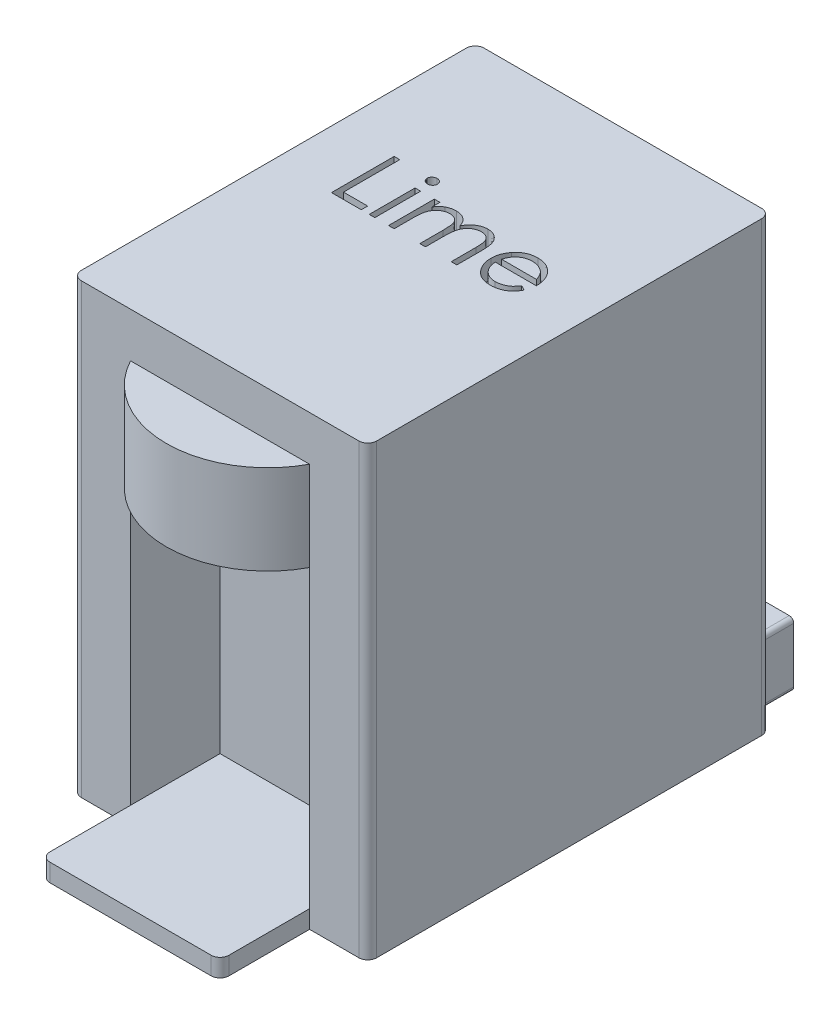
from build123d import *

# Parameters (mm, degrees)
SKETCH1_W           = 330
SKETCH1_H           = 450
BOSS_EXTRUDE1_DEPTH = 500
SKETCH2_W           = 200
SKETCH2_H           = 350
CUT_EXTRUDE1_DEPTH  = 100
BOSS_EXTRUDE2_DEPTH = 100
SKETCH4_W           = 200
SKETCH4_H           = 20
BOSS_EXTRUDE3_DEPTH = 200
SKETCH5_R           = 58.984993577
CUT_EXTRUDE2_DEPTH  = 50
FILLET1_R           = 10
SKETCH6_W           = 108.793875533
SKETCH6_H           = 71.48855694
BOSS_EXTRUDE4_DEPTH = 50
FILLET2_R           = 5
FILLET3_R           = 10
SKETCH7_W           = 6.282051282
SKETCH7_H           = 51.153846154
CUT_EXTRUDE3_DEPTH  = 20


with BuildPart() as part:
    # Sketch1 → Boss-Extrude1 (new body)
    with BuildSketch(Plane(origin=(0, 0, 0), x_dir=(1, 0, 0), z_dir=(0, 1, 0))):
        Rectangle(SKETCH1_W, SKETCH1_H)
    extrude(amount=BOSS_EXTRUDE1_DEPTH)

    # Sketch2 → Cut-Extrude1 (cut)
    with BuildSketch(Plane.XY.offset(225)):
        with Locations((0, 175)):
            Rectangle(SKETCH2_W, SKETCH2_H)
    extrude(amount=-CUT_EXTRUDE1_DEPTH, mode=Mode.SUBTRACT)

    # Sketch3 → Boss-Extrude2 (add)
    with BuildSketch(Plane.XZ.offset(-350)):
        with BuildLine():
            Line((100, 225), (-100, 225))
            ThreePointArc((-100, 225), (0, 284.9775435), (100, 225))
        make_face()
    extrude(amount=-BOSS_EXTRUDE2_DEPTH)

    # Sketch4 → Boss-Extrude3 (add)
    with BuildSketch(Plane.XY.offset(125)):
        with Locations((0, 10)):
            Rectangle(SKETCH4_W, SKETCH4_H)
    extrude(amount=BOSS_EXTRUDE3_DEPTH)

    # Sketch5 → Cut-Extrude2 (cut)
    with BuildSketch(Plane.XZ.offset(-350)):
        with Locations((0, 203.171289973)):
            Circle(SKETCH5_R)
    extrude(amount=-CUT_EXTRUDE2_DEPTH, mode=Mode.SUBTRACT)

    # Fillet1
    fillet1_edges = [part.edges().sort_by_distance(p)[0] for p in [
        (165, 250, 225),
        (-165, 250, 225),
        (-165, 250, -225),
        (165, 250, -225),
    ]]
    fillet(fillet1_edges, radius=FILLET1_R)

    # Sketch6 → Boss-Extrude4 (add)
    with BuildSketch(Plane(origin=(0, 0, -225), x_dir=(-1, 0, 0), z_dir=(0, 0, -1))):
        with Locations((-86.447180312, 35.74427847)):
            Rectangle(SKETCH6_W, SKETCH6_H)
    extrude(amount=BOSS_EXTRUDE4_DEPTH)

    # Fillet2
    fillet2_edges = [part.edges().sort_by_distance(p)[0] for p in [
        (140.844118078, 71.48855694, -250),
        (140.844118078, 0, -250),
        (32.050242545, 0, -250),
        (32.050242545, 71.48855694, -250),
    ]]
    fillet(fillet2_edges, radius=FILLET2_R)

    # Fillet3
    fillet3_edges = [part.edges().sort_by_distance(p)[0] for p in [
        (-100, 10, 325),
        (100, 10, 325),
    ]]
    fillet(fillet3_edges, radius=FILLET3_R)

    # Sketch7 → Cut-Extrude3 (cut)
    # profile 1 of 5: a face of its own
    with BuildSketch(Plane(origin=(0, 500, 0), x_dir=(1, 0, 0), z_dir=(0, 1, 0))):
        Polygon((-100.512820513, 70), (-94.230769231, 70), (-94.230769231, 7.179487179), (-67.307692308, 7.179487179), (-67.307692308, 0), (-100.512820513, 0), align=None)
    # profile 2 of 5: a face of its own
    with BuildSketch(Plane(origin=(0, 500, 0), x_dir=(1, 0, 0), z_dir=(0, 1, 0))):
        with BuildLine():
            add(Edge.make_bspline(
                [(-55.220352564, 72.692307692), (-54.830526248, 72.674224644), (-54.067171451, 72.638814564), (-52.963306098, 72.335585022), (-51.958165856, 71.821591313), (-51.066611199, 71.131997695), (-50.301573465, 70.321008826), (-49.765959258, 69.37578946), (-49.421711335, 68.354616684), (-49.38014023, 67.642314901), (-49.358974359, 67.279647436)],
                knots=[0, 0, 0, 0, 1.055194115, 2.066272739, 3.074728998, 4.095836921, 5.109056067, 6.073838105, 7.019297344, 8, 8, 8, 8], degree=3))
            add(Edge.make_bspline(
                [(-49.358974359, 67.279647436), (-49.380617555, 66.926394373), (-49.423403594, 66.228054872), (-49.765693359, 65.224585431), (-50.306138115, 64.292499762), (-51.066120628, 63.483085557), (-51.958295848, 62.793873158), (-52.963271565, 62.279778379), (-54.067180535, 61.976575632), (-54.830529319, 61.941161857), (-55.220352564, 61.923076923)],
                knots=[0, 0, 0, 0, 0.96129708, 1.900370562, 2.859976407, 3.87933698, 4.906634145, 5.921202961, 6.938410037, 8, 8, 8, 8], degree=3))
            add(Edge.make_bspline(
                [(-55.220352564, 61.923076923), (-55.605718067, 61.940471328), (-56.355781671, 61.974327263), (-57.443118518, 62.285727618), (-58.439688305, 62.79404908), (-59.332981759, 63.478572782), (-60.077585621, 64.297470726), (-60.619552129, 65.224016603), (-60.961051367, 66.228199696), (-61.003943939, 66.926443022), (-61.025641026, 67.279647436)],
                knots=[0, 0, 0, 0, 1.054934014, 2.053291228, 3.073705704, 4.106921865, 5.123545215, 6.088680038, 7.033164197, 8, 8, 8, 8], degree=3))
            add(Edge.make_bspline(
                [(-61.025641026, 67.279647436), (-61.004419293, 67.642264428), (-60.962738472, 68.35446708), (-60.619296149, 69.376367739), (-60.082099994, 70.315997775), (-59.332488723, 71.136507763), (-58.439819518, 71.821416458), (-57.443084615, 72.329636089), (-56.355790627, 72.641062876), (-55.605721107, 72.674915163), (-55.220352564, 72.692307692)],
                knots=[0, 0, 0, 0, 0.98631895, 1.937192651, 2.907499808, 3.917963147, 4.944918757, 5.95915025, 6.951458133, 8, 8, 8, 8], degree=3))
        make_face()
    # profile 3 of 5: a face of its own
    with BuildSketch(Plane(origin=(0, 500, 0), x_dir=(1, 0, 0), z_dir=(0, 1, 0))):
        with Locations((-55.192307692, 25.576923077)):
            Rectangle(SKETCH7_W, SKETCH7_H)
    # profile 4 of 5: a face of its own
    with BuildSketch(Plane(origin=(0, 500, 0), x_dir=(1, 0, 0), z_dir=(0, 1, 0))):
        with BuildLine():
            Line((-36.794871795, 51.153846154), (-30.512820513, 51.153846154))
            Line((-30.512820513, 51.153846154), (-30.512820513, 42.263621795))
            add(Edge.make_bspline(
                [(-30.512820513, 42.263621795), (-29.947141515, 43.041373829), (-28.863246322, 44.531621291), (-27.085933272, 46.495426975), (-25.310411023, 48.161990069), (-24.031743387, 49.036847501), (-23.417467949, 49.45713141)],
                knots=[0, 0, 0, 0, 1.134379233, 2.173579362, 3.122582517, 4, 4, 4, 4], degree=3))
            add(Edge.make_bspline(
                [(-23.417467949, 49.45713141), (-22.580174705, 49.857238715), (-20.92021671, 50.650462982), (-18.291832212, 51.455134161), (-15.602338821, 51.949636188), (-13.786174543, 52.017263656), (-12.872596154, 52.051282051)],
                knots=[0, 0, 0, 0, 1.014936303, 2.012140481, 3.000054389, 4, 4, 4, 4], degree=3))
            add(Edge.make_bspline(
                [(-12.872596154, 52.051282051), (-12.254736222, 52.030376236), (-11.032024642, 51.989004751), (-9.22034284, 51.719804047), (-7.463170603, 51.254480587), (-5.770890016, 50.606334107), (-4.176476431, 49.821400369), (-2.714692476, 48.900406211), (-1.402208312, 47.866464703), (-0.239687286, 46.672886043), (0.805693222, 45.286154073), (1.767270154, 43.668869095), (2.655774402, 41.784715873), (3.148200579, 40.417385054), (3.407451923, 39.697516026)],
                knots=[0, 0, 0, 0, 1.009824226, 1.998387844, 2.986035974, 3.974953746, 4.955485308, 5.885931332, 6.793869504, 7.679848016, 8.601185859, 9.625726857, 10.749998409, 12, 12, 12, 12], degree=3))
            add(Edge.make_bspline(
                [(3.407451923, 39.697516026), (3.68167695, 40.192004411), (4.221313293, 41.16508811), (5.127426034, 42.542253355), (6.076781964, 43.830389192), (7.077471825, 45.030517679), (8.125963562, 46.136712288), (9.227191568, 47.152630321), (10.374887196, 48.082634594), (11.970731994, 49.169097785), (14.046984142, 50.323121412), (16.664746436, 51.323690292), (19.387749868, 51.942012859), (21.236103834, 52.014618316), (22.169471154, 52.051282051)],
                knots=[0, 0, 0, 0, 0.86119277, 1.694706429, 2.50939023, 3.298075842, 4.073795165, 4.829715201, 5.57930267, 6.321991688, 7.768977793, 9.186738141, 10.579381044, 12, 12, 12, 12], degree=3))
            add(Edge.make_bspline(
                [(22.169471154, 52.051282051), (23.02710041, 52.018937634), (24.705564135, 51.955636469), (27.14910945, 51.458567003), (29.427945556, 50.60501406), (31.537487079, 49.440341329), (33.440683347, 47.976757663), (35.095009531, 46.23538091), (36.490416797, 44.22852845), (37.401989591, 42.340688676), (38.020294876, 40.673982019), (38.401519562, 39.253856193), (38.738313464, 37.690825135), (39.017938369, 35.983019905), (39.222309411, 34.124407739), (39.373723721, 32.118030221), (39.476205192, 29.962327989), (39.483446637, 28.475017984), (39.487179487, 27.708333333)],
                knots=[0, 0, 0, 0, 1.209669288, 2.367440248, 3.500751976, 4.631527125, 5.755587489, 6.87532382, 8.007944318, 9.190864318, 9.82315674, 10.514484317, 11.263564316, 12.079023757, 12.955305781, 13.901327259, 14.918167583, 16, 16, 16, 16], degree=3))
            Line((39.487179487, 27.708333333), (39.487179487, 0))
            Line((39.487179487, 0), (33.205128205, 0))
            Line((33.205128205, 0), (33.205128205, 27.736378205))
            add(Edge.make_bspline(
                [(33.205128205, 27.736378205), (33.203570546, 28.390789684), (33.200576961, 29.648469021), (33.14670433, 31.453518045), (33.045198049, 33.09888519), (32.926505273, 34.582326953), (32.761629086, 35.907302723), (32.548710451, 37.071151094), (32.323156853, 38.083027321), (31.948437031, 39.204748273), (31.349479198, 40.442152483), (30.437129598, 41.776623999), (29.287727472, 42.938240003), (27.960524341, 43.946606339), (26.449555447, 44.766479161), (24.784260984, 45.351999355), (22.974979952, 45.714456923), (21.722524184, 45.750577235), (21.075721154, 45.769230769)],
                knots=[0, 0, 0, 0, 1.253487763, 2.409012846, 3.458416907, 4.410876679, 5.259312806, 6.014470957, 6.676830364, 7.243083969, 8.276244668, 9.299465089, 10.325150304, 11.392391894, 12.482080715, 13.603491619, 14.762376348, 16, 16, 16, 16], degree=3))
            add(Edge.make_bspline(
                [(21.075721154, 45.769230769), (20.282322066, 45.740907621), (18.714263843, 45.684930314), (16.425354118, 45.113452855), (14.225933786, 44.251847842), (12.181631128, 43.003198699), (10.301075316, 41.507031422), (8.68308376, 39.728039507), (7.346440047, 37.715440968), (6.441360528, 35.852506922), (5.869574503, 34.179118044), (5.492036188, 32.717170604), (5.198368359, 31.055539248), (4.922957774, 29.20538943), (4.743203215, 27.153985823), (4.579835769, 24.910817803), (4.503418512, 22.469138615), (4.492729337, 20.776604842), (4.487179487, 19.897836538)],
                knots=[0, 0, 0, 0, 1.090531906, 2.155305635, 3.229839962, 4.33261226, 5.44038871, 6.529323825, 7.629011124, 8.757537029, 9.370236727, 10.061839251, 10.834451254, 11.692844982, 12.636905849, 13.66920014, 14.789842145, 16, 16, 16, 16], degree=3))
            Line((4.487179487, 19.897836538), (4.487179487, 0))
            Line((4.487179487, 0), (-1.794871795, 0))
            Line((-1.794871795, 0), (-1.794871795, 26.01161859))
            add(Edge.make_bspline(
                [(-1.794871795, 26.01161859), (-1.796460414, 26.745484965), (-1.799516759, 28.157370109), (-1.853043105, 30.182043615), (-1.954775539, 32.023665217), (-2.072386506, 33.680094493), (-2.241590077, 35.148321069), (-2.433785319, 36.436216229), (-2.660757529, 37.54055125), (-3.036555222, 38.751818948), (-3.610844588, 40.086237407), (-4.534609827, 41.509057831), (-5.686761435, 42.754419781), (-7.038178952, 43.81759475), (-8.558292596, 44.696424376), (-10.237960612, 45.329619412), (-12.062058869, 45.698105204), (-13.319612987, 45.745075138), (-13.966346154, 45.769230769)],
                knots=[0, 0, 0, 0, 1.320475261, 2.540461679, 3.643808994, 4.639130445, 5.527981419, 6.302341397, 6.981980563, 7.553956391, 8.582137848, 9.585246428, 10.591171744, 11.620968678, 12.668337649, 13.738356861, 14.836885341, 16, 16, 16, 16], degree=3))
            add(Edge.make_bspline(
                [(-13.966346154, 45.769230769), (-14.726670383, 45.738621569), (-16.241969571, 45.67761852), (-18.468008964, 45.128533043), (-20.617722636, 44.268451547), (-22.656816612, 43.075255166), (-24.530299578, 41.597273594), (-26.170464924, 39.858975678), (-27.549315435, 37.881995008), (-28.463951733, 36.038704678), (-29.053921215, 34.40723918), (-29.445827909, 33.020220226), (-29.782620425, 31.480215261), (-30.032900859, 29.782473039), (-30.274509171, 27.938051156), (-30.391115353, 25.937761362), (-30.504546596, 23.783319608), (-30.50999489, 22.295868703), (-30.512820513, 21.524439103)],
                knots=[0, 0, 0, 0, 1.098833095, 2.189935336, 3.297829714, 4.440610912, 5.596351641, 6.740013378, 7.886572111, 9.072425424, 9.705826452, 10.395263256, 11.156850408, 11.985370555, 12.878090359, 13.847760091, 14.883794034, 16, 16, 16, 16], degree=3))
            Line((-30.512820513, 21.524439103), (-30.512820513, 0))
            Line((-30.512820513, 0), (-36.794871795, 0))
            Line((-36.794871795, 0), (-36.794871795, 51.153846154))
        make_face()
    # profile 5 of 5: a face of its own
    with BuildSketch(Plane(origin=(0, 500, 0), x_dir=(1, 0, 0), z_dir=(0, 1, 0))):
        with BuildLine():
            Line((95.829326923, 16.153846154), (101.41025641, 13.223157051))
            add(Edge.make_bspline(
                [(101.41025641, 13.223157051), (100.965524505, 12.434290426), (100.100252336, 10.899468369), (98.612237378, 8.79083116), (97.052395926, 6.893876843), (95.350316566, 5.259283758), (93.556922987, 3.834256058), (91.662269892, 2.587499564), (89.656493537, 1.525129157), (87.539499041, 0.630078599), (85.293508018, -0.058111283), (82.91307769, -0.544195701), (80.393647783, -0.844661074), (78.666724185, -0.87956389), (77.782451923, -0.897435897)],
                knots=[0, 0, 0, 0, 1.120438281, 2.179929193, 3.190490725, 4.156257408, 5.095198341, 6.022838206, 6.959905092, 7.901321166, 8.864066838, 9.862729781, 10.905609505, 12, 12, 12, 12], degree=3))
            add(Edge.make_bspline(
                [(77.782451923, -0.897435897), (76.799612372, -0.874492391), (74.882377139, -0.829736256), (72.091582197, -0.443886968), (69.463993829, 0.185560206), (66.999759762, 1.064871036), (64.70491471, 2.213417518), (62.574897614, 3.612607154), (60.598507097, 5.255252248), (58.838022913, 7.155581118), (57.253145259, 9.189220263), (55.854628859, 11.308337953), (54.685480238, 13.507602443), (53.734428034, 15.773012923), (52.966330735, 18.090290794), (52.43099666, 20.480520146), (52.1224017, 22.937231831), (52.075112789, 24.599178545), (52.051282051, 25.436698718)],
                knots=[0, 0, 0, 0, 1.145258523, 2.234067595, 3.276747158, 4.290159414, 5.277019952, 6.260822364, 7.254936242, 8.264827045, 9.274100331, 10.257902744, 11.220704747, 12.172965371, 13.118907548, 14.062713208, 15.023725156, 16, 16, 16, 16], degree=3))
            add(Edge.make_bspline(
                [(52.051282051, 25.436698718), (52.072464878, 26.222595326), (52.114446443, 27.78013862), (52.379062191, 30.085449511), (52.848028052, 32.326018561), (53.491554531, 34.503707521), (54.322579455, 36.6148702), (55.339223839, 38.660791473), (56.543071395, 40.63929427), (57.47252487, 41.887356944), (57.940705128, 42.516025641)],
                knots=[0, 0, 0, 0, 1.024358464, 2.0301432, 3.019427413, 4.004406732, 4.986367066, 5.972626655, 6.978780325, 8, 8, 8, 8], degree=3))
            add(Edge.make_bspline(
                [(57.940705128, 42.516025641), (58.574858784, 43.273403043), (59.823077716, 44.764166052), (61.934204823, 46.722932567), (64.22020875, 48.363808071), (66.652441272, 49.723950794), (69.259170753, 50.757423734), (72.005356574, 51.527575378), (74.922268298, 51.959135599), (76.916372715, 52.020092271), (77.936698718, 52.051282051)],
                knots=[0, 0, 0, 0, 1.030682036, 2.02871468, 2.997146059, 3.962720338, 4.930598197, 5.918074684, 6.934738563, 8, 8, 8, 8], degree=3))
            add(Edge.make_bspline(
                [(77.936698718, 52.051282051), (78.985650824, 52.024201073), (81.043455743, 51.971074368), (84.044098164, 51.4785477), (86.883312494, 50.697496609), (89.559962581, 49.594420799), (92.074319796, 48.171229763), (94.410040787, 46.408392933), (96.607071038, 44.360031189), (97.885242615, 42.784767), (98.535657051, 41.983173077)],
                knots=[0, 0, 0, 0, 1.056321875, 2.072262726, 3.055038591, 4.01806755, 4.982017516, 5.957941055, 6.960871419, 8, 8, 8, 8], degree=3))
            add(Edge.make_bspline(
                [(98.535657051, 41.983173077), (98.978195818, 41.379101449), (99.860327679, 40.174979075), (100.96526968, 38.211555933), (101.92441758, 36.157344046), (102.6910768, 33.979138105), (103.311866824, 31.702746501), (103.761003199, 29.311895607), (104.024395571, 26.80729738), (104.076169517, 25.10076627), (104.102564103, 24.230769231)],
                knots=[0, 0, 0, 0, 0.94817472, 1.890038105, 2.849395472, 3.817997239, 4.812318967, 5.836947057, 6.897266129, 8, 8, 8, 8], degree=3))
            Line((104.102564103, 24.230769231), (58.333333333, 24.230769231))
            add(Edge.make_bspline(
                [(58.333333333, 24.230769231), (58.364125462, 23.556759946), (58.424676941, 22.231347871), (58.706979804, 20.291932209), (59.15195528, 18.444465366), (59.777336532, 16.702804526), (60.534673438, 15.044201976), (61.462387773, 13.480961237), (62.569178852, 12.020202636), (63.80369284, 10.648859884), (65.177834747, 9.427644661), (66.623489691, 8.334609136), (68.161360991, 7.418497201), (69.779322661, 6.674899406), (71.474758364, 6.092773085), (73.248202266, 5.695416671), (75.096164593, 5.429274534), (76.355879274, 5.39968123), (76.997195513, 5.384615385)],
                knots=[0, 0, 0, 0, 1.094153842, 2.151609401, 3.174256925, 4.172055639, 5.149267565, 6.128595816, 7.11444997, 8.118368179, 9.117203808, 10.09244225, 11.054858984, 12.015122123, 12.976791628, 13.957293641, 14.960065497, 16, 16, 16, 16], degree=3))
            add(Edge.make_bspline(
                [(76.997195513, 5.384615385), (77.624218465, 5.396776518), (78.868352283, 5.420906539), (80.72116943, 5.655544757), (82.543959978, 6.03495027), (84.329179644, 6.552750071), (86.040596562, 7.184287113), (87.625507563, 7.946344266), (89.083111876, 8.789339201), (90.445451207, 9.753532702), (91.766871074, 10.933696442), (93.077720803, 12.406410862), (94.48325387, 14.148161418), (95.363045725, 15.459074737), (95.829326923, 16.153846154)],
                knots=[0, 0, 0, 0, 0.99110716, 1.966546729, 2.947904876, 3.932708344, 4.903319531, 5.828989031, 6.710028674, 7.56322171, 8.463672341, 9.504779593, 10.677557249, 12, 12, 12, 12], degree=3))
        make_face()
        with BuildLine():
            add(Edge.make_bspline(
                [(97.820512821, 30.512820513), (97.590580329, 31.346077987), (97.1480343, 32.949830399), (96.223307011, 35.170648208), (95.181876197, 37.144406228), (93.949441569, 38.855998889), (92.553067057, 40.376069149), (90.940163404, 41.704440852), (89.131445534, 42.892789873), (87.13626272, 43.895839863), (85.023427019, 44.749637037), (82.81130318, 45.322139352), (80.554147422, 45.714330198), (79.027461695, 45.750852367), (78.259214744, 45.769230769)],
                knots=[0, 0, 0, 0, 1.154881502, 2.222775134, 3.210006277, 4.132804581, 5.035138423, 5.962687519, 6.919655026, 7.923214229, 8.944639381, 9.960483929, 10.97369054, 12, 12, 12, 12], degree=3))
            add(Edge.make_bspline(
                [(78.259214744, 45.769230769), (77.632225973, 45.756997338), (76.392800992, 45.732814417), (74.566779628, 45.503411831), (72.81318565, 45.124214933), (71.119079898, 44.604915801), (69.50666253, 43.912743751), (67.942767166, 43.101079219), (66.467159241, 42.110247543), (65.544333332, 41.355070446), (65.078125, 40.973557692)],
                knots=[0, 0, 0, 0, 1.04873581, 2.073130211, 3.073294108, 4.04793562, 5.032784715, 6.005352987, 6.992311501, 8, 8, 8, 8], degree=3))
            add(Edge.make_bspline(
                [(65.078125, 40.973557692), (64.744259361, 40.67167138), (64.068596676, 40.060727059), (63.165786246, 39.008142928), (62.301376793, 37.873111684), (61.514703738, 36.612209193), (60.793152008, 35.239793612), (60.117952465, 33.767440908), (59.510224223, 32.183978302), (59.168302022, 31.080529518), (58.992387821, 30.512820513)],
                knots=[0, 0, 0, 0, 0.879870761, 1.780643979, 2.707998968, 3.669668524, 4.684282772, 5.740141944, 6.837334558, 8, 8, 8, 8], degree=3))
            Line((58.992387821, 30.512820513), (97.820512821, 30.512820513))
        make_face(mode=Mode.SUBTRACT)
    extrude(amount=-CUT_EXTRUDE3_DEPTH, mode=Mode.SUBTRACT)


solid = part.part
